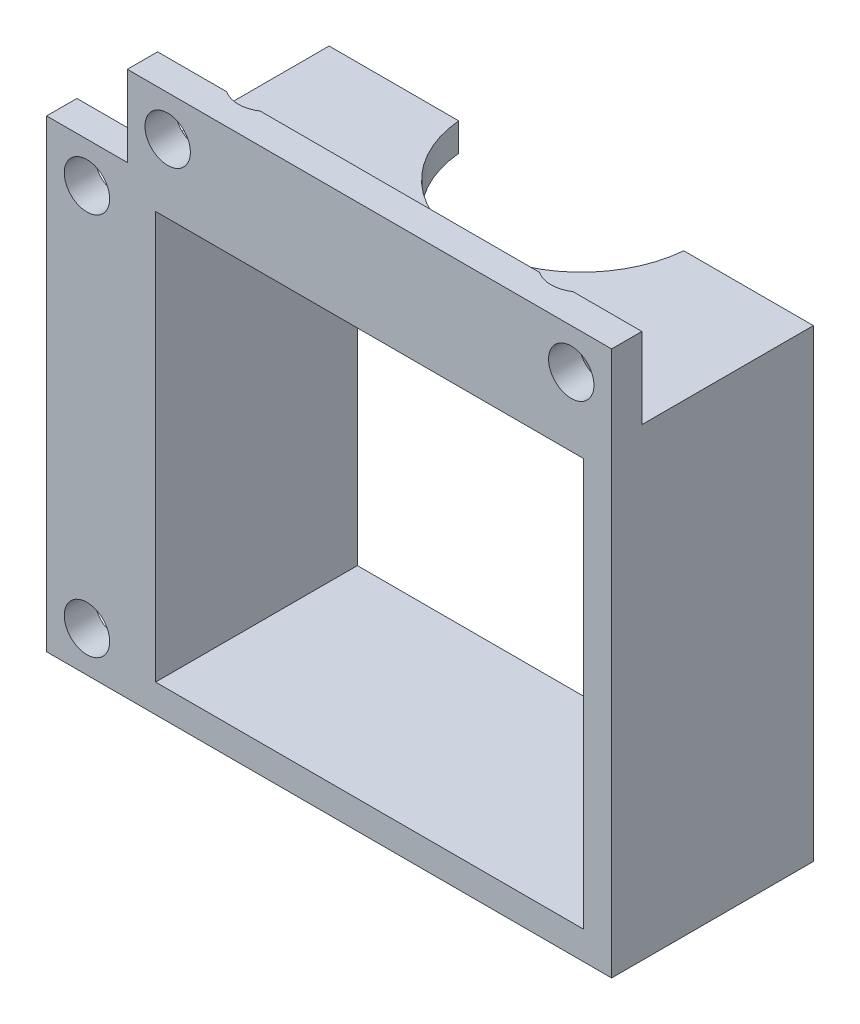
from build123d import *

# Parameters (mm, degrees)
SKETCH1_W           = 48
SKETCH1_H           = 46
SKETCH1_W_2         = 42.4
SKETCH1_H_2         = 40.4
BOSS_EXTRUDE1_DEPTH = 20
CUT_EXTRUDE1_REACH  = 59.498
SKETCH3_R           = 11.2
CUT_EXTRUDE2_REACH  = 59.498
SKETCH5_R           = 1.7
SKETCH6_W           = 8
SKETCH6_H           = 46
SKETCH6_R           = 2.25
SKETCH6_W_2         = 48
SKETCH6_H_2         = 8
BOSS_EXTRUDE2_DEPTH = 3
SKETCH7_R           = 3
CUT_EXTRUDE3_DEPTH  = 8


with BuildPart() as part:
    # Sketch1 → Boss-Extrude1 (new body)
    with BuildSketch(Plane.XY):
        with Locations((-4.106729999, -49.5)):
            Rectangle(SKETCH1_W, SKETCH1_H)
        with Locations((-4.106729999, -49.5)):
            Rectangle(SKETCH1_W_2, SKETCH1_H_2, mode=Mode.SUBTRACT)
    extrude(amount=-BOSS_EXTRUDE1_DEPTH)

    # Sketch3 → Cut-Extrude1 (cut, up to next)
    with BuildSketch(Plane(origin=(0, -26.5, 0), x_dir=(1, 0, 0), z_dir=(0, 1, 0)), mode=Mode.PRIVATE) as cut_extrude1_sk1:
        with Locations((-4.106729999, 21)):
            Circle(SKETCH3_R)
    cut_extrude1_tool1 = extrude(cut_extrude1_sk1.sketch, amount=-CUT_EXTRUDE1_REACH, mode=Mode.PRIVATE) & part.part
    add(cut_extrude1_tool1.solids().sort_by_distance((-4.10673, -26.5, -21))[0], mode=Mode.SUBTRACT)

    # Sketch5 → Cut-Extrude2 (cut, up to next)
    with BuildSketch(Plane(origin=(0, -26.5, 0), x_dir=(1, 0, 0), z_dir=(0, 1, 0)), mode=Mode.PRIVATE) as cut_extrude2_sk1:
        with Locations(Location((11.393270001, 5.5, 0), (0, 0, 270))):
            Circle(SKETCH5_R)
    cut_extrude2_tool1 = extrude(cut_extrude2_sk1.sketch, amount=-CUT_EXTRUDE2_REACH, mode=Mode.PRIVATE) & part.part
    # Sketch5 → Cut-Extrude2 (cut, up to next)
    with BuildSketch(Plane(origin=(0, -26.5, 0), x_dir=(1, 0, 0), z_dir=(0, 1, 0)), mode=Mode.PRIVATE) as cut_extrude2_sk2:
        with Locations(Location((-19.606729999, 5.5, 0), (0, 0, 270))):
            Circle(SKETCH5_R)
    cut_extrude2_tool2 = extrude(cut_extrude2_sk2.sketch, amount=-CUT_EXTRUDE2_REACH, mode=Mode.PRIVATE) & part.part
    add(cut_extrude2_tool1.solids().sort_by_distance((11.39327, -26.5, -5.5))[0], mode=Mode.SUBTRACT)
    add(cut_extrude2_tool2.solids().sort_by_distance((-19.60673, -26.5, -5.5))[0], mode=Mode.SUBTRACT)

    # Sketch6 → Boss-Extrude2 (add)
    # profile 1 of 2: a face of its own
    with BuildSketch(Plane.XY):
        with Locations((-32.106729999, -49.5)):
            Rectangle(SKETCH6_W, SKETCH6_H)
        with Locations((-32.106729999, -68.5)):
            Circle(SKETCH6_R, mode=Mode.SUBTRACT)
        with Locations((-32.106729999, -30.5)):
            Circle(SKETCH6_R, mode=Mode.SUBTRACT)
    # profile 2 of 2: a face of its own
    with BuildSketch(Plane.XY):
        with Locations((-4.106729999, -22.5)):
            Rectangle(SKETCH6_W_2, SKETCH6_H_2)
        with Locations((-24.106729999, -22.5)):
            Circle(SKETCH6_R, mode=Mode.SUBTRACT)
        with Locations((15.893270001, -22.5)):
            Circle(SKETCH6_R, mode=Mode.SUBTRACT)
    extrude(amount=-BOSS_EXTRUDE2_DEPTH)

    # Sketch7 → Cut-Extrude3 (cut)
    with BuildSketch(Plane(origin=(0, -18.5, 0), x_dir=(1, 0, 0), z_dir=(0, 1, 0))):
        with Locations((11.393270001, 5.5)):
            Circle(SKETCH7_R)
        with Locations((-19.606729999, 5.5)):
            Circle(SKETCH7_R)
    extrude(amount=-CUT_EXTRUDE3_DEPTH, mode=Mode.SUBTRACT)


solid = part.part
